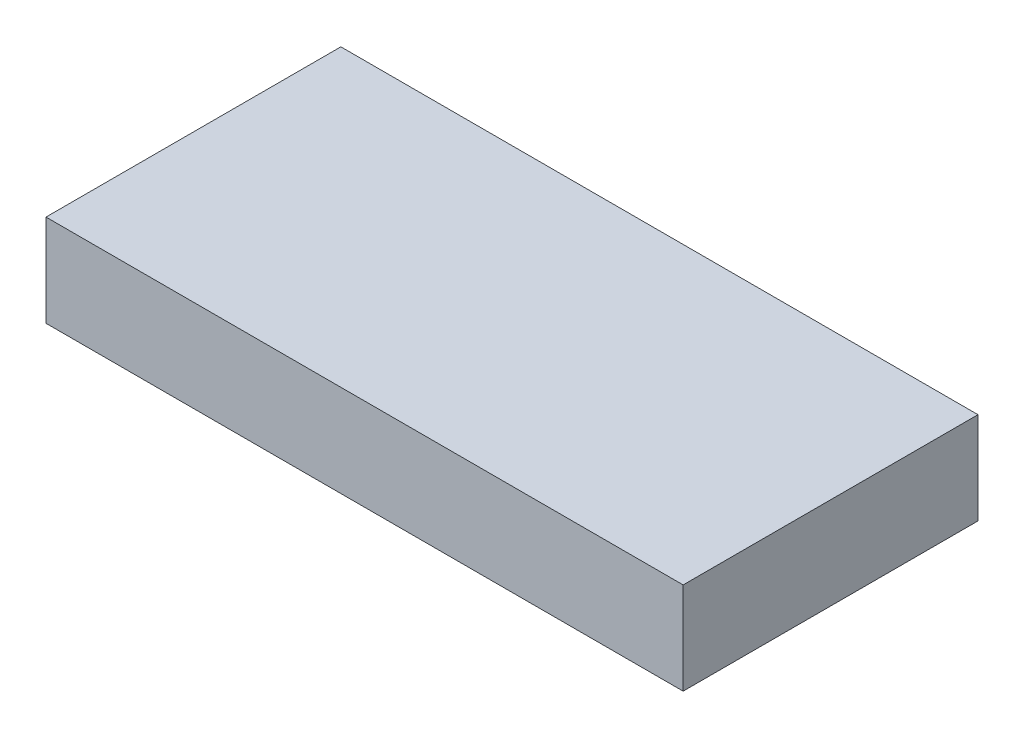
from build123d import *

# Parameters (mm, degrees)
SKETCH1_W           = 1800
SKETCH1_H           = 833
BOSS_EXTRUDE1_DEPTH = 260


with BuildPart() as part:
    # Sketch1 → Boss-Extrude1 (new body)
    with BuildSketch(Plane(origin=(0, 0, 0), x_dir=(1, 0, 0), z_dir=(0, 1, 0))):
        with Locations((900, 416.5)):
            Rectangle(SKETCH1_W, SKETCH1_H)
    extrude(amount=BOSS_EXTRUDE1_DEPTH)


solid = part.part
